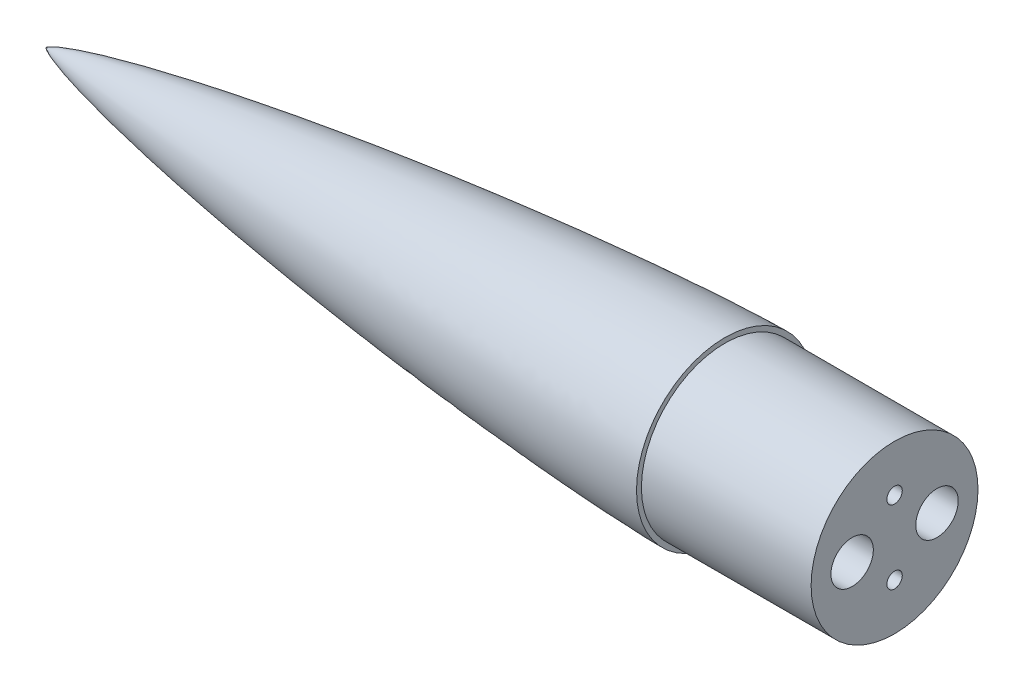
from build123d import *

# Parameters (mm, degrees)
SKETCH2_R           = 37.465
BOSS_EXTRUDE1_DEPTH = 50.8
SKETCH3_R           = 9.525
CUT_REVOLVE1_ANGLE  = 180
SKETCH4_R           = 37.465
SKETCH4_R_2         = 9.525
BOSS_EXTRUDE2_DEPTH = 25.4
SKETCH5_R           = 3.4671
CUT_EXTRUDE1_DEPTH  = 254


with BuildPart() as part:
    # Sketch1 → Revolve1 (revolve)
    with BuildSketch(Plane.XY):
        with BuildLine():
            Line((0, 0), (304.8, 0))
            Line((304.8, 0), (304.8, 39.6748))
            add(Edge.make_bspline(
                [(0, 0), (0.001990016, 0.006380343), (0.00701971, 0.018647451), (0.02144512, 0.041133145), (0.054977521, 0.082482136), (0.104001435, 0.131550788), (0.168386027, 0.187594696), (0.261246618, 0.26037229), (0.388654902, 0.350880875), (0.581878865, 0.475164865), (0.906754263, 0.663154837), (1.458542633, 0.94838722), (2.421507462, 1.387921999), (4.163311697, 2.085133875), (7.330620723, 3.184538925), (12.605144246, 4.765142981), (22.086176793, 7.229960877), (35.434892871, 10.199581229), (51.943243843, 13.427910643), (70.826030727, 16.720256354), (89.756201504, 19.724478891), (108.72270084, 22.489997643), (127.717963157, 25.049113562), (146.737633519, 27.420133683), (165.778389571, 29.614813334), (184.838106864, 31.638406979), (203.915143101, 33.491467662), (223.008423973, 35.16936619), (242.117188184, 36.660980831), (261.241034269, 37.946600905), (277.448292398, 38.829280667), (289.805240869, 39.3397638), (298.30529744, 39.58036416), (302.01635164, 39.649528), (303.872082374, 39.671991977), (304.8, 39.6748)],
                knots=[0, 0, 0, 0, 0, 8.6237e-05, 0.000172473, 0.000344946, 0.000689892, 0.00098475, 0.001279607, 0.001875338, 0.002717212, 0.003964713, 0.006148621, 0.009932249, 0.016447924, 0.028301276, 0.049639613, 0.081363147, 0.143539844, 0.20571656, 0.267893272, 0.330069984, 0.392246696, 0.454423407, 0.516600119, 0.578776833, 0.640953546, 0.703130258, 0.765306971, 0.827483684, 0.889660397, 0.95183711, 0.975918555, 0.987959278, 1, 1, 1, 1, 1], degree=4))
        make_face()
    revolve(axis=Axis((0, 0, 0), (1, 0, 0)))

    # Sketch2 → Boss-Extrude1 (add)
    with BuildSketch(Plane(origin=(304.8, 0, 0), x_dir=(0, 0, -1), z_dir=(1, 0, 0))):
        with Locations(Location((0, 0, 0), (0, 0, 180))):
            Circle(SKETCH2_R)
    extrude(amount=BOSS_EXTRUDE1_DEPTH)

    # Sketch3 → Cut-Revolve1 (revolve, cut)
    with BuildSketch(Plane(origin=(355.6, 0, 0), x_dir=(0, 0, -1), z_dir=(1, 0, 0))):
        with Locations((-19.05, 0)):
            Circle(SKETCH3_R)
    revolve(axis=Axis((355.6, 37.465, 0), (0, -1, 0)), revolution_arc=CUT_REVOLVE1_ANGLE, mode=Mode.SUBTRACT)

    # Sketch4 → Boss-Extrude2 (add)
    with BuildSketch(Plane(origin=(355.6, 0, 0), x_dir=(0, 0, -1), z_dir=(1, 0, 0))):
        with Locations(Location((0, 0, 0), (0, 0, 180))):
            Circle(SKETCH4_R)
        with Locations(Location((-19.05, 0, 0), (0, 0, 180))):
            Circle(SKETCH4_R_2, mode=Mode.SUBTRACT)
        with Locations((19.05, 0)):
            Circle(SKETCH4_R_2, mode=Mode.SUBTRACT)
    extrude(amount=BOSS_EXTRUDE2_DEPTH)

    # Sketch5 → Cut-Extrude1 (cut)
    with BuildSketch(Plane(origin=(381, 0, 0), x_dir=(0, 0, -1), z_dir=(1, 0, 0))):
        with Locations((0, 16.51)):
            Circle(SKETCH5_R)
        with Locations((0, -16.51)):
            Circle(SKETCH5_R)
    extrude(amount=-CUT_EXTRUDE1_DEPTH, mode=Mode.SUBTRACT)


solid = part.part
